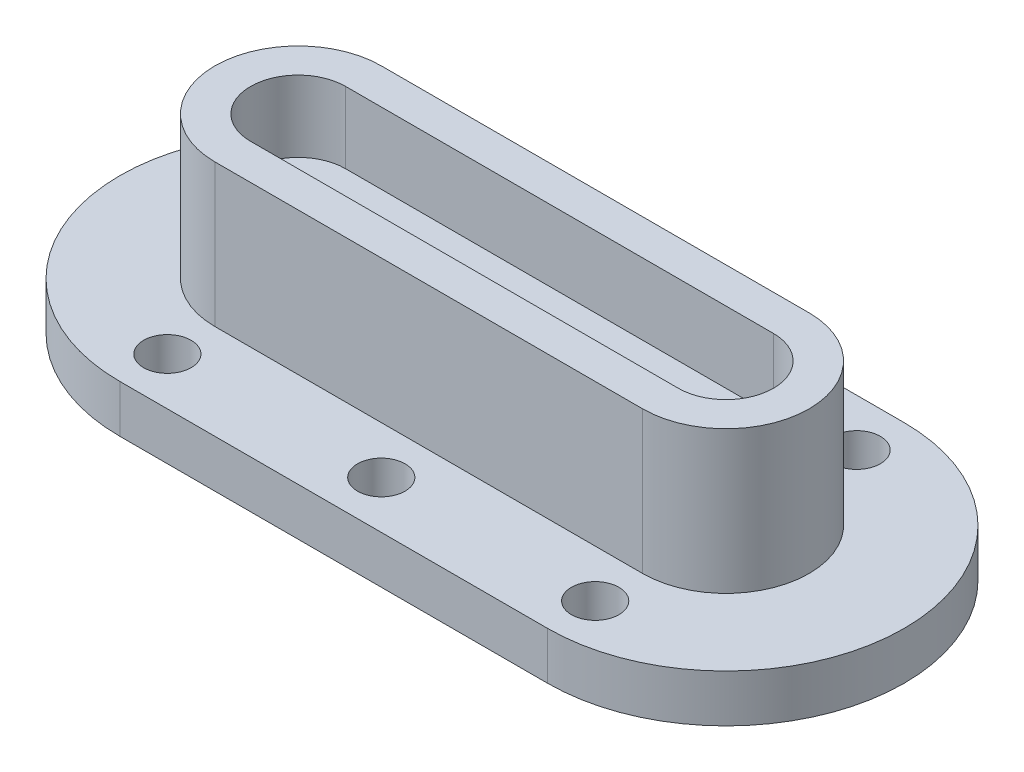
from build123d import *

# Parameters (mm, degrees)
SKETCH1_R           = 10
SKETCH1_R_2         = 7.5
BOSS_EXTRUDE1_DEPTH = 20
SKETCH1_4_R         = 7.5
BOSS_EXTRUDE2_DEPTH = 50
BOSS_EXTRUDE3_DEPTH = 80


with BuildPart() as part:
    # Sketch1 → Boss-Extrude1 (new body)
    with BuildSketch(Plane(origin=(0, 0, 0), x_dir=(1, 0, 0), z_dir=(0, 1, 0))):
        with BuildLine():
            Line((-90, -75), (90, -75))
            ThreePointArc((90, -75), (165, 0), (90, 75))
            Line((90, 75), (-90, 75))
            ThreePointArc((-90, 75), (-165, 0), (-90, -75))
        make_face()
        with Locations((-90, -55)):
            Circle(SKETCH1_R, mode=Mode.SUBTRACT)
        with Locations((0, -55)):
            Circle(SKETCH1_R, mode=Mode.SUBTRACT)
        with Locations((90, -55)):
            Circle(SKETCH1_R, mode=Mode.SUBTRACT)
        with Locations((-90, 55)):
            Circle(SKETCH1_R, mode=Mode.SUBTRACT)
        with Locations((0, 55)):
            Circle(SKETCH1_R, mode=Mode.SUBTRACT)
        with Locations((90, 55)):
            Circle(SKETCH1_R, mode=Mode.SUBTRACT)
        with Locations((90, 0)):
            Circle(SKETCH1_R_2, mode=Mode.SUBTRACT)
        with Locations((-90, 0)):
            Circle(SKETCH1_R_2, mode=Mode.SUBTRACT)
        Circle(SKETCH1_R_2, mode=Mode.SUBTRACT)
    extrude(amount=BOSS_EXTRUDE1_DEPTH)

    # Sketch1<4> → Boss-Extrude2 (add)
    with BuildSketch(Plane(origin=(0, 0, 0), x_dir=(1, 0, 0), z_dir=(0, 1, 0))):
        with BuildLine():
            Line((-90, -20), (90, -20))
            ThreePointArc((90, -20), (110, 0), (90, 20))
            Line((90, 20), (-90, 20))
            ThreePointArc((-90, 20), (-110, 0), (-90, -20))
        make_face()
        with Locations((-90, 0)):
            Circle(SKETCH1_4_R, mode=Mode.SUBTRACT)
        Circle(SKETCH1_4_R, mode=Mode.SUBTRACT)
        with Locations((90, 0)):
            Circle(SKETCH1_4_R, mode=Mode.SUBTRACT)
    extrude(amount=BOSS_EXTRUDE2_DEPTH)

    # Sketch1<5> → Boss-Extrude3 (add)
    with BuildSketch(Plane(origin=(0, 0, 0), x_dir=(1, 0, 0), z_dir=(0, 1, 0))):
        with BuildLine():
            Line((-90, -35), (90, -35))
            ThreePointArc((90, -35), (125, 0), (90, 35))
            Line((90, 35), (-90, 35))
            ThreePointArc((-90, 35), (-125, 0), (-90, -35))
        make_face()
        with BuildLine():
            ThreePointArc((90, 20), (110, 0), (90, -20))
            Line((90, -20), (-90, -20))
            ThreePointArc((-90, -20), (-110, 0), (-90, 20))
            Line((-90, 20), (90, 20))
        make_face(mode=Mode.SUBTRACT)
    extrude(amount=BOSS_EXTRUDE3_DEPTH)


solid = part.part
